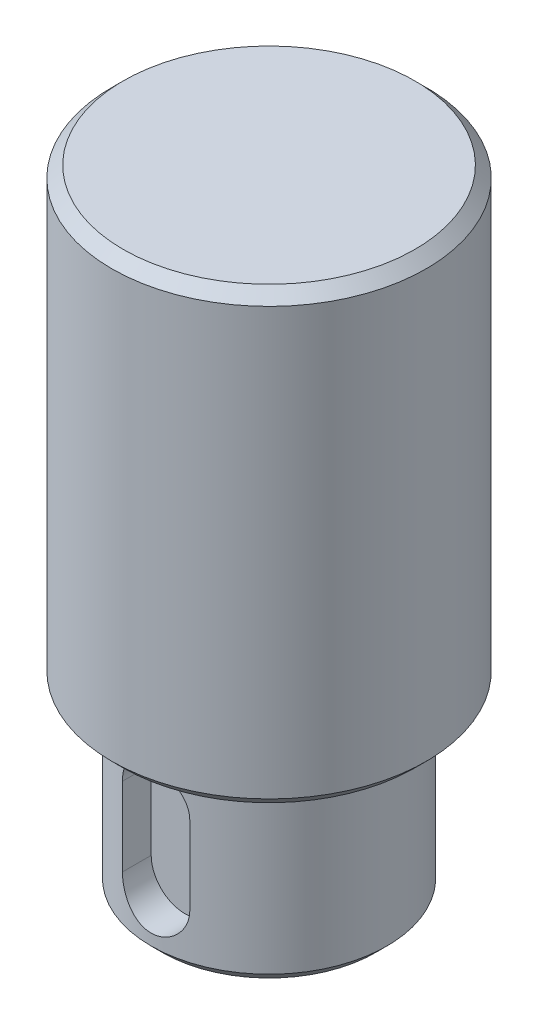
from build123d import *

# Parameters (mm, degrees)
SKETCH3_R           = 14
BOSS_EXTRUDE2_DEPTH = 56
SKETCH3_4_R         = 14
SKETCH3_4_R_2       = 10.5
CUT_EXTRUDE1_DEPTH  = 16
CHAMFER1_SIZE       = 1
CUT_EXTRUDE2_DEPTH  = 16


with BuildPart() as part:
    # Sketch3 → Boss-Extrude2 (new body)
    with BuildSketch(Plane(origin=(0, 0, 0), x_dir=(1, 0, 0), z_dir=(0, 1, 0))):
        Circle(SKETCH3_R)
    extrude(amount=BOSS_EXTRUDE2_DEPTH)

    # Sketch3<4> → Cut-Extrude1 (cut)
    with BuildSketch(Plane(origin=(0, 0, 0), x_dir=(1, 0, 0), z_dir=(0, 1, 0))):
        Circle(SKETCH3_4_R)
        Circle(SKETCH3_4_R_2, mode=Mode.SUBTRACT)
    extrude(amount=CUT_EXTRUDE1_DEPTH, mode=Mode.SUBTRACT)

    # Chamfer1
    chamfer1_edges = [part.edges().sort_by_distance(p)[0] for p in [
        (-14, 56, 0),
        (-14, 16, 0),
        (-10.5, 0, 0),
    ]]
    chamfer(chamfer1_edges, length=CHAMFER1_SIZE)

    # Sketch5 → Cut-Extrude2 (cut)
    with BuildSketch(Plane.XY.offset(7.5)):
        with BuildLine():
            Line((-3, 5), (-3, 12))
            ThreePointArc((-3, 12), (0, 15), (3, 12))
            Line((3, 12), (3, 5))
            ThreePointArc((3, 5), (0, 2), (-3, 5))
        make_face()
    extrude(amount=CUT_EXTRUDE2_DEPTH, mode=Mode.SUBTRACT)


solid = part.part
